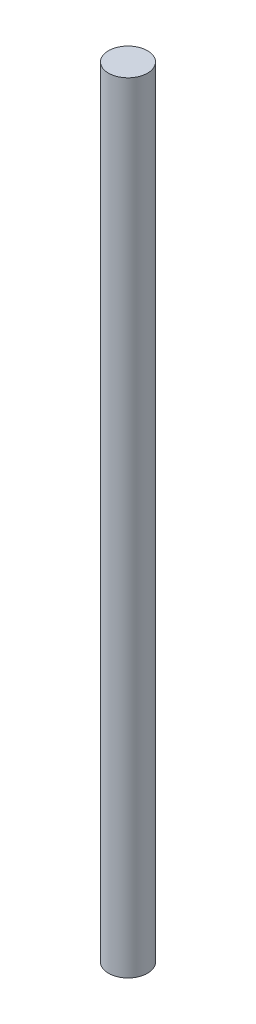
from build123d import *

# Parameters (mm, degrees)
ESQUISSE1_R        = 3
BOSS_EXTRU_1_DEPTH = 120


with BuildPart() as part:
    # Esquisse1 → Boss.-Extru.1 (new body)
    with BuildSketch(Plane(origin=(0, 0, 0), x_dir=(1, 0, 0), z_dir=(0, 1, 0))):
        with Locations(Location((0, 0, 0), (0, 0, 270))):
            Circle(ESQUISSE1_R)
    extrude(amount=BOSS_EXTRU_1_DEPTH)


solid = part.part
